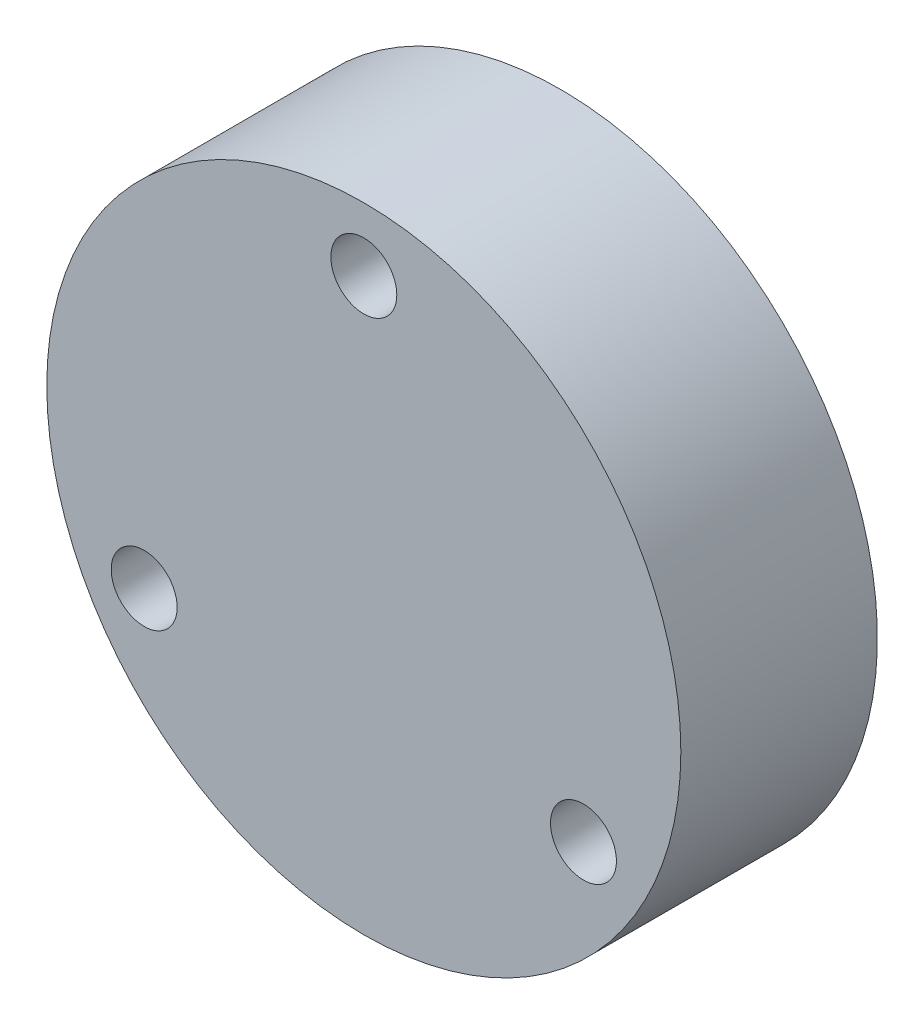
from build123d import *

# Parameters (mm, degrees)
SKETCH_1_R          = 12.5
EXTRUDE_1_DEPTH     = 12
SKETCH_2_R          = 1.3
CUT_EXTRUDE_1_DEPTH = 22.365860619
SKETCH_3_R          = 12.5
SKETCH_3_R_2        = 5
CUT_EXTRUDE_2_DEPTH = 4.25
EXTRUDE_START       = 1
SKETCH_4_R          = 6
SKETCH_4_R_2        = 5
EXTRUDE_2_DEPTH     = 1


with BuildPart() as part:
    # ｽｹｯﾁ1 → ﾎﾞｽ - 押し出し1 (new body)
    with BuildSketch(Plane.XY):
        Circle(SKETCH_1_R)
    extrude(amount=EXTRUDE_1_DEPTH)

    # ｽｹｯﾁ2 → ｶｯﾄ - 押し出し1 (cut, through all)
    with BuildSketch(Plane.XY.offset(12)):
        with Locations((0, 10)):
            Circle(SKETCH_2_R)
        with Locations((8.660254038, -5)):
            Circle(SKETCH_2_R)
        with Locations((-8.660254038, -5)):
            Circle(SKETCH_2_R)
    extrude(amount=-CUT_EXTRUDE_1_DEPTH, mode=Mode.SUBTRACT)

    # ｽｹｯﾁ3 → ｶｯﾄ - 押し出し2 (cut)
    with BuildSketch(Plane(origin=(0, 0, 0), x_dir=(-1, 0, 0), z_dir=(0, 0, -1))):
        Circle(SKETCH_3_R)
        Circle(SKETCH_3_R_2, mode=Mode.SUBTRACT)
    extrude(amount=-CUT_EXTRUDE_2_DEPTH, mode=Mode.SUBTRACT)

    # ｽｹｯﾁ4 → ﾎﾞｽ - 押し出し2 (add)
    with BuildSketch(Plane(origin=(0, 0, 4.25), x_dir=(-1, 0, 0), z_dir=(0, 0, -1)).offset(EXTRUDE_START)):
        Circle(SKETCH_4_R)
        Circle(SKETCH_4_R_2, mode=Mode.SUBTRACT)
    extrude(amount=-EXTRUDE_2_DEPTH)


solid = part.part
